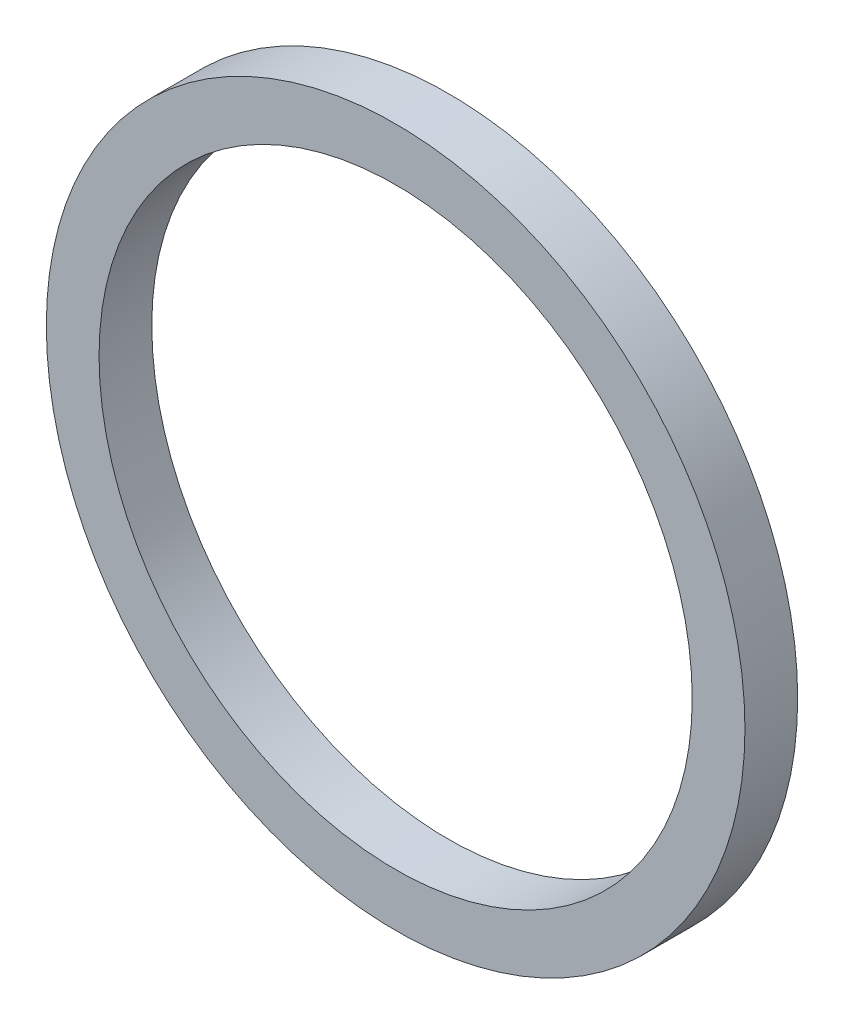
from build123d import *

# Parameters (mm, degrees)
SKETCH_1_R      = 53
SKETCH_1_R_2    = 45
EXTRUDE_1_DEPTH = 4


with BuildPart() as part:
    # 草图1 → 凸台-拉伸1 (new, symmetric)
    with BuildSketch(Plane.XY):
        Circle(SKETCH_1_R)
        Circle(SKETCH_1_R_2, mode=Mode.SUBTRACT)
    extrude(amount=EXTRUDE_1_DEPTH, both=True)


solid = part.part
